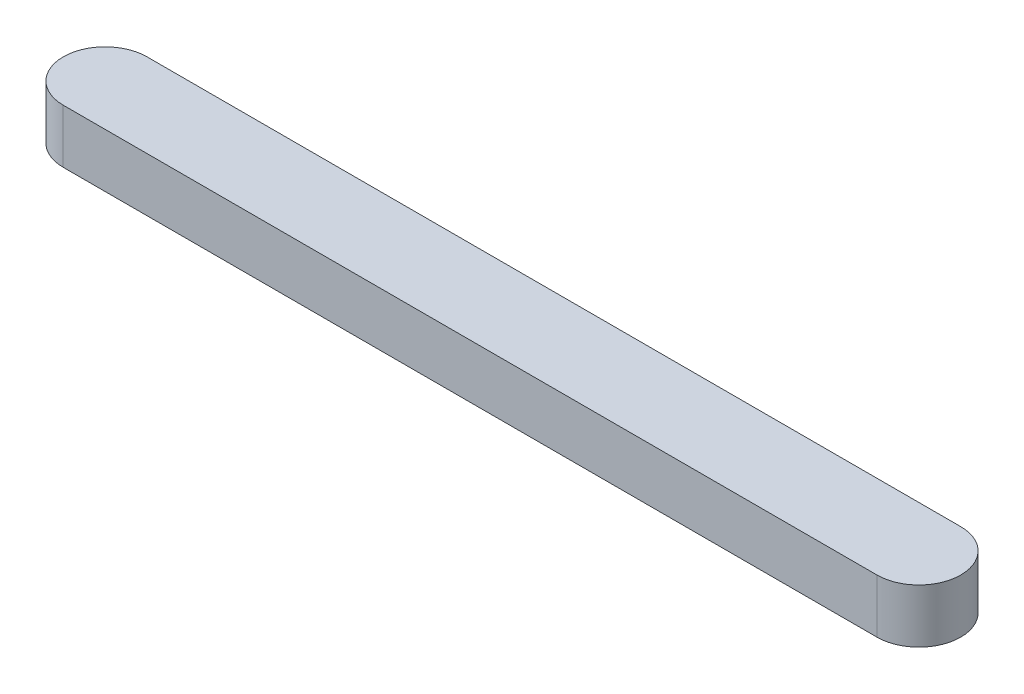
from build123d import *

# Parameters (mm, degrees)
EXTRUDE_1_DEPTH = 9


with BuildPart() as part:
    # Эскиз1 → Бобышка-Вытянуть1 (new body)
    with BuildSketch(Plane(origin=(0, 0, 0), x_dir=(1, 0, 0), z_dir=(0, 1, 0))):
        with BuildLine():
            Line((-68, 7), (68, 7))
            ThreePointArc((68, 7), (75, 0), (68, -7))
            Line((68, -7), (-68, -7))
            ThreePointArc((-68, -7), (-75, 0), (-68, 7))
        make_face()
    extrude(amount=EXTRUDE_1_DEPTH)


solid = part.part
